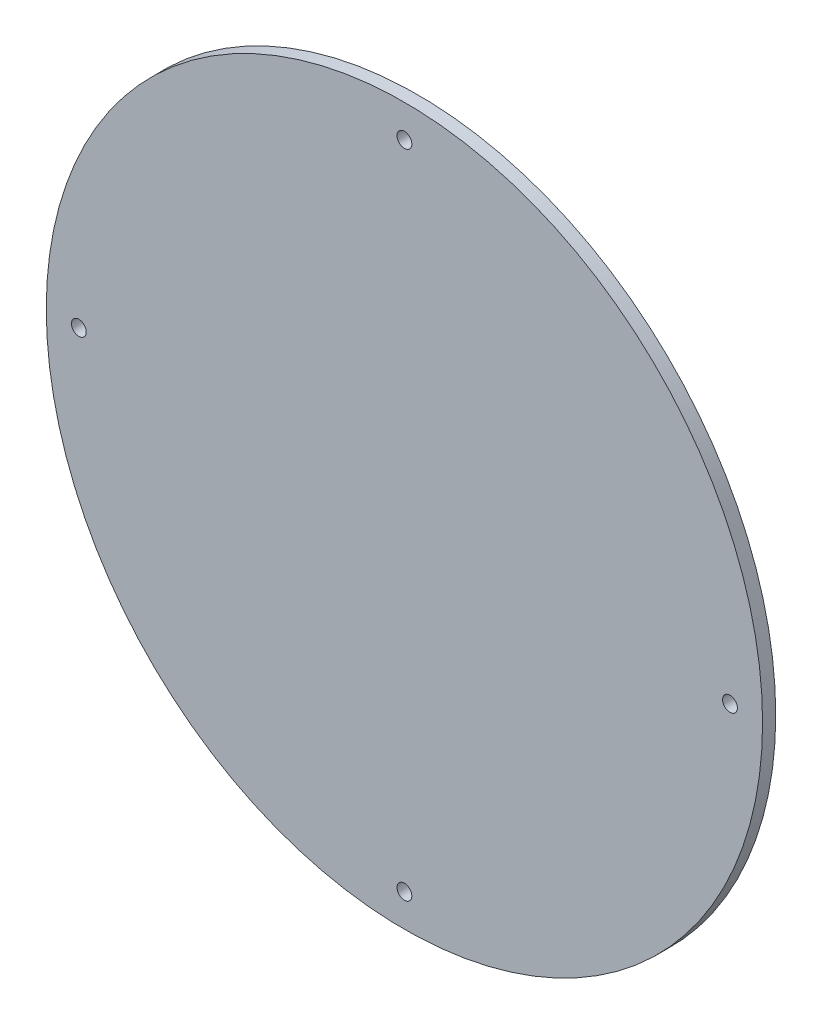
from build123d import *

# Parameters (mm, degrees)
SKETCH1_R           = 86.36
SKETCH1_R_2         = 1.7859375
BOSS_EXTRUDE1_DEPTH = 3.175


with BuildPart() as part:
    # Sketch1 → Boss-Extrude1 (new body)
    with BuildSketch(Plane.XY):
        Circle(SKETCH1_R)
        with Locations((-78.5, 0)):
            Circle(SKETCH1_R_2, mode=Mode.SUBTRACT)
        with Locations((0, -78.5)):
            Circle(SKETCH1_R_2, mode=Mode.SUBTRACT)
        with Locations((78.5, 0)):
            Circle(SKETCH1_R_2, mode=Mode.SUBTRACT)
        with Locations((0, 78.5)):
            Circle(SKETCH1_R_2, mode=Mode.SUBTRACT)
    extrude(amount=BOSS_EXTRUDE1_DEPTH)


solid = part.part
